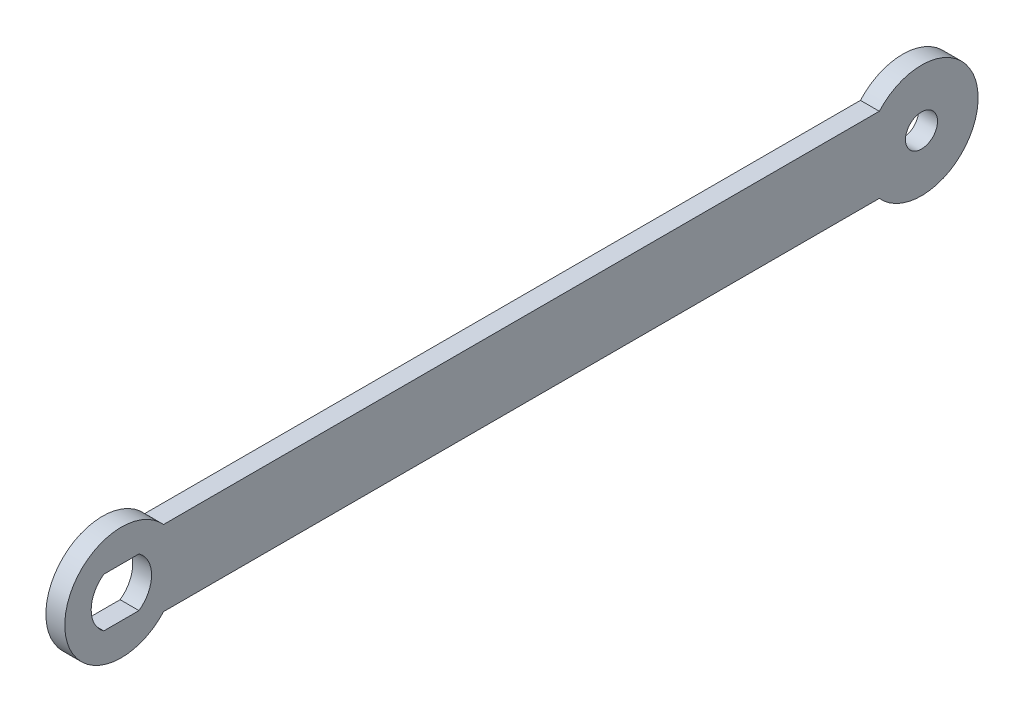
from build123d import *

# Parameters (mm, degrees)
BOSS_EXTRU_1_DEPTH = 5
TROU_TARAUD_M101_D = 8.5


with BuildPart() as part:
    # Esquisse1 → Boss.-Extru.1 (new body)
    with BuildSketch(Plane(origin=(0, 0, 0), x_dir=(0, 0, -1), z_dir=(1, 0, 0))):
        with BuildLine():
            Line((11.180339887, 10), (200.819660113, 10))
            ThreePointArc((200.819660113, 10), (227, 0), (200.819660113, -10))
            Line((200.819660113, -10), (11.180339887, -10))
            ThreePointArc((11.180339887, -10), (-15, 0), (11.180339887, 10))
        make_face()
        with BuildLine():
            Line((-4.663689527, -6.5), (4.663689527, -6.5))
            ThreePointArc((4.663689527, -6.5), (8, 0), (4.663689527, 6.5))
            Line((4.663689527, 6.5), (-4.663689527, 6.5))
            ThreePointArc((-4.663689527, 6.5), (-8, 0), (-4.663689527, -6.5))
        make_face(mode=Mode.SUBTRACT)
    extrude(amount=BOSS_EXTRU_1_DEPTH)

    # Trou taraudé M101 (through all)
    with Locations(Plane(origin=(5, 0, 0), x_dir=(0, 0, -1), z_dir=(1, 0, 0))):
        with Locations((212, 0)):
            Hole(TROU_TARAUD_M101_D / 2)


solid = part.part
